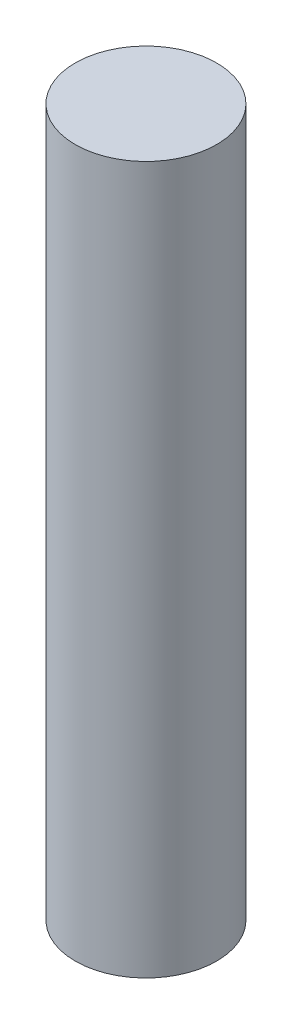
from build123d import *

# Parameters (mm, degrees)
SKETCH1_R           = 1.397
BOSS_EXTRUDE1_DEPTH = 13.97


with BuildPart() as part:
    # Sketch1 → Boss-Extrude1 (new body)
    with BuildSketch(Plane(origin=(0, 0, 0), x_dir=(1, 0, 0), z_dir=(0, 1, 0))):
        with Locations(Location((0, 0, 0), (0, 0, 270))):
            Circle(SKETCH1_R)
    extrude(amount=BOSS_EXTRUDE1_DEPTH)


solid = part.part
